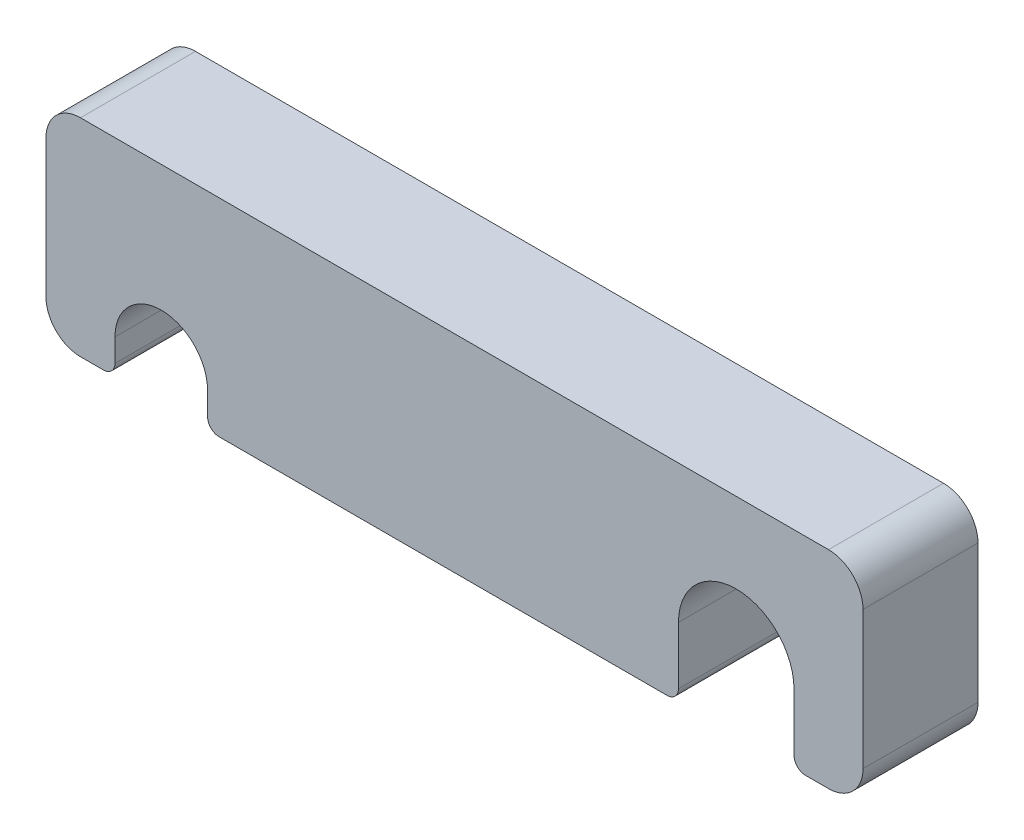
from build123d import *

# Parameters (mm, degrees)
BOSS_EXTRUDE1_DEPTH = 10


with BuildPart() as part:
    # Sketch1 → Boss-Extrude1 (new body)
    with BuildSketch(Plane.XY):
        with BuildLine():
            Line((6, 3), (6, 1))
            ThreePointArc((6, 1), (5.707106781, 0.292893219), (5, 0))
            Line((5, 0), (3, 0))
            ThreePointArc((3, 0), (0.878679656, 0.878679656), (0, 3))
            Line((0, 3), (0, 15))
            ThreePointArc((0, 15), (0.878679656, 17.121320344), (3, 18))
            Line((3, 18), (68.05, 18))
            ThreePointArc((68.05, 18), (70.171320344, 17.121320344), (71.05, 15))
            Line((71.05, 15), (71.05, 3))
            ThreePointArc((71.05, 3), (70.171320344, 0.878679656), (68.05, 0))
            Line((68.05, 0), (66.05, 0))
            ThreePointArc((66.05, 0), (65.342893219, 0.292893219), (65.05, 1))
            Line((65.05, 1), (65.05, 6))
            ThreePointArc((65.05, 6), (60.025, 11.025), (55, 6))
            Line((55, 6), (55, 1))
            ThreePointArc((55, 1), (54.707106781, 0.292893219), (54, 0))
            Line((54, 0), (15.05, 0))
            ThreePointArc((15.05, 0), (14.342893219, 0.292893219), (14.05, 1))
            Line((14.05, 1), (14.05, 3))
            ThreePointArc((14.05, 3), (10.025, 7.025), (6, 3))
        make_face()
    extrude(amount=BOSS_EXTRUDE1_DEPTH)


solid = part.part
